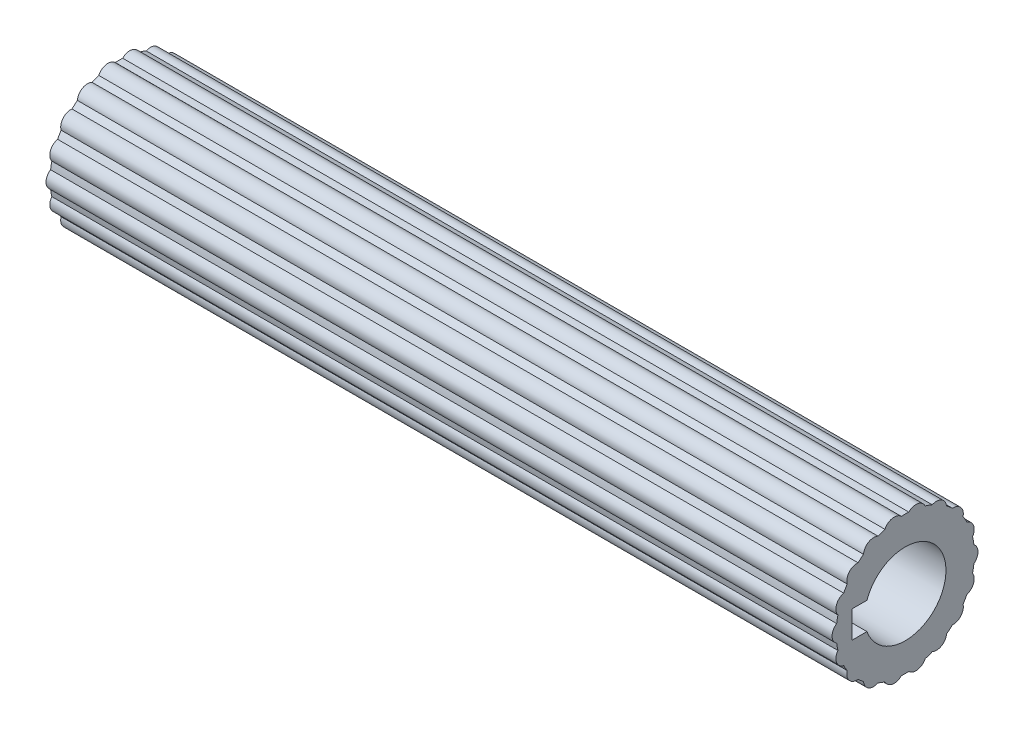
from build123d import *

# Parameters (mm, degrees)
SKETCH1_W               = 30
SKETCH1_H               = 5.1
CIRPATTERN1_COUNT       = 18
CUT_EXTRUDE2_DEPTH      = 1
CUT_EXTRUDE2_DEPTH_BACK = 1
SKETCH13_R              = 5.864313224
CUT_EXTRUDE3_DEPTH      = 1
CUT_EXTRUDE3_DEPTH_BACK = 1
SKETCH14_R              = 6.155891313
CUT_EXTRUDE4_DEPTH      = 59.492599661


with BuildPart() as part:
    # Sketch1 → Revolve1 (revolve)
    with BuildSketch(Plane(origin=(0, 0, 0), x_dir=(-1, 0, 0), z_dir=(0, 1, 0))):
        with Locations((-15, 2.55)):
            Rectangle(SKETCH1_W, SKETCH1_H)
    revolve1 = revolve(axis=Axis((0, 0, 0), (1, 0, 0)))

    # Sweep3: sweep along a path in Sketch2
    with BuildLine(Plane(origin=(0, 0, 0), x_dir=(-1, 0, 0), z_dir=(0, 1, 0))) as sweep3_path:
        Line((-30, 5.1), (0, 5.1))
    # Sketch3 → Sweep3 (sweep)
    with BuildSketch(Plane(origin=(0, 0, 0), x_dir=(0, -1, 0), z_dir=(-1, 0, 0))):
        with BuildLine():
            Line((0.75, 4.65), (0.75, 2.55))
            ThreePointArc((0.75, 2.55), (0, 1.8), (-0.75, 2.55))
            Line((-0.75, 2.55), (-0.75, 4.65))
            ThreePointArc((-0.75, 4.65), (0, 5.4), (0.75, 4.65))
        make_face()
    sweep3 = sweep(path=sweep3_path.line)

    # CirPattern1: Sweep3 ×18 about axis
    cirpattern1_axis = Axis((0, 0, 0.01696711), (1, 0, 0))
    for i in range(1, CIRPATTERN1_COUNT):
        add(sweep3.rotate(cirpattern1_axis, i * 360 / CIRPATTERN1_COUNT))

    # Mirror1: Revolve1, Sweep3 across plane
    add(revolve1.mirror(Plane(origin=(0, 0, 0), x_dir=(0, 0, 1), z_dir=(1, 0, 0))))
    add(sweep3.mirror(Plane(origin=(0, 0, 0), x_dir=(0, 0, 1), z_dir=(1, 0, 0))))

    # Mirror1 copy 1: sweep along a path in Mirror1 copy 1 path
    with BuildLine(Plane(origin=(0, 0.005803093, 0.001023242), x_dir=(1, 0, 0), z_dir=(0, 0.9396926207859084, 0.3420201433256687))) as mirror1_copy_1_path:
        Line((-30, -5.1), (0, -5.1))
    # Mirror1 copy 1 sketch → Mirror1 copy 1 (sweep)
    with BuildSketch(Plane(origin=(0, 0.005803093, 0.001023242), x_dir=(0, -0.9396926207859084, -0.3420201433256687), z_dir=(1, 0, 0))):
        with BuildLine():
            Line((0.75, -4.65), (0.75, -2.55))
            ThreePointArc((0.75, -2.55), (0, -1.8), (-0.75, -2.55))
            Line((-0.75, -2.55), (-0.75, -4.65))
            ThreePointArc((-0.75, -4.65), (0, -5.4), (0.75, -4.65))
        make_face()
    sweep(path=mirror1_copy_1_path.line)

    # Mirror1 copy 2: sweep along a path in Mirror1 copy 2 path
    with BuildLine(Plane(origin=(0, 0.010906248, 0.00396955), x_dir=(1, 0, 0), z_dir=(0, 0.766044443118978, 0.6427876096865393))) as mirror1_copy_2_path:
        Line((-30, -5.1), (0, -5.1))
    # Mirror1 copy 2 sketch → Mirror1 copy 2 (sweep)
    with BuildSketch(Plane(origin=(0, 0.010906248, 0.00396955), x_dir=(0, -0.766044443118978, -0.6427876096865393), z_dir=(1, 0, 0))):
        with BuildLine():
            Line((0.75, -4.65), (0.75, -2.55))
            ThreePointArc((0.75, -2.55), (0, -1.8), (-0.75, -2.55))
            Line((-0.75, -2.55), (-0.75, -4.65))
            ThreePointArc((-0.75, -4.65), (0, -5.4), (0.75, -4.65))
        make_face()
    sweep(path=mirror1_copy_2_path.line)

    # Mirror1 copy 3: sweep along a path in Mirror1 copy 3 path
    with BuildLine(Plane(origin=(0, 0.014693948, 0.008483555), x_dir=(1, 0, 0), z_dir=(0, 0.5000000000000001, 0.8660254037844386))) as mirror1_copy_3_path:
        Line((-30, -5.1), (0, -5.1))
    # Mirror1 copy 3 sketch → Mirror1 copy 3 (sweep)
    with BuildSketch(Plane(origin=(0, 0.014693948, 0.008483555), x_dir=(0, -0.5000000000000001, -0.8660254037844386), z_dir=(1, 0, 0))):
        with BuildLine():
            Line((0.75, -4.65), (0.75, -2.55))
            ThreePointArc((0.75, -2.55), (0, -1.8), (-0.75, -2.55))
            Line((-0.75, -2.55), (-0.75, -4.65))
            ThreePointArc((-0.75, -4.65), (0, -5.4), (0.75, -4.65))
        make_face()
    sweep(path=mirror1_copy_3_path.line)

    # Mirror1 copy 4: sweep along a path in Mirror1 copy 4 path
    with BuildLine(Plane(origin=(0, 0.016709341, 0.014020802), x_dir=(1, 0, 0), z_dir=(0, 0.17364817766693041, 0.984807753012208))) as mirror1_copy_4_path:
        Line((-30, -5.1), (0, -5.1))
    # Mirror1 copy 4 sketch → Mirror1 copy 4 (sweep)
    with BuildSketch(Plane(origin=(0, 0.016709341, 0.014020802), x_dir=(0, -0.17364817766693041, -0.984807753012208), z_dir=(1, 0, 0))):
        with BuildLine():
            Line((0.75, -4.65), (0.75, -2.55))
            ThreePointArc((0.75, -2.55), (0, -1.8), (-0.75, -2.55))
            Line((-0.75, -2.55), (-0.75, -4.65))
            ThreePointArc((-0.75, -4.65), (0, -5.4), (0.75, -4.65))
        make_face()
    sweep(path=mirror1_copy_4_path.line)

    # Mirror1 copy 5: sweep along a path in Mirror1 copy 5 path
    with BuildLine(Plane(origin=(0, 0.016709341, 0.019913417), x_dir=(1, 0, 0), z_dir=(0, -0.1736481776669303, 0.984807753012208))) as mirror1_copy_5_path:
        Line((-30, -5.1), (0, -5.1))
    # Mirror1 copy 5 sketch → Mirror1 copy 5 (sweep)
    with BuildSketch(Plane(origin=(0, 0.016709341, 0.019913417), x_dir=(0, 0.1736481776669303, -0.984807753012208), z_dir=(1, 0, 0))):
        with BuildLine():
            Line((0.75, -4.65), (0.75, -2.55))
            ThreePointArc((0.75, -2.55), (0, -1.8), (-0.75, -2.55))
            Line((-0.75, -2.55), (-0.75, -4.65))
            ThreePointArc((-0.75, -4.65), (0, -5.4), (0.75, -4.65))
        make_face()
    sweep(path=mirror1_copy_5_path.line)

    # Mirror1 copy 6: sweep along a path in Mirror1 copy 6 path
    with BuildLine(Plane(origin=(0, 0.014693948, 0.025450665), x_dir=(1, 0, 0), z_dir=(0, -0.4999999999999998, 0.8660254037844387))) as mirror1_copy_6_path:
        Line((-30, -5.1), (0, -5.1))
    # Mirror1 copy 6 sketch → Mirror1 copy 6 (sweep)
    with BuildSketch(Plane(origin=(0, 0.014693948, 0.025450665), x_dir=(0, 0.4999999999999998, -0.8660254037844387), z_dir=(1, 0, 0))):
        with BuildLine():
            Line((0.75, -4.65), (0.75, -2.55))
            ThreePointArc((0.75, -2.55), (0, -1.8), (-0.75, -2.55))
            Line((-0.75, -2.55), (-0.75, -4.65))
            ThreePointArc((-0.75, -4.65), (0, -5.4), (0.75, -4.65))
        make_face()
    sweep(path=mirror1_copy_6_path.line)

    # Mirror1 copy 7: sweep along a path in Mirror1 copy 7 path
    with BuildLine(Plane(origin=(0, 0.010906248, 0.02996467), x_dir=(1, 0, 0), z_dir=(0, -0.7660444431189779, 0.6427876096865395))) as mirror1_copy_7_path:
        Line((-30, -5.1), (0, -5.1))
    # Mirror1 copy 7 sketch → Mirror1 copy 7 (sweep)
    with BuildSketch(Plane(origin=(0, 0.010906248, 0.02996467), x_dir=(0, 0.7660444431189779, -0.6427876096865395), z_dir=(1, 0, 0))):
        with BuildLine():
            Line((0.75, -4.65), (0.75, -2.55))
            ThreePointArc((0.75, -2.55), (0, -1.8), (-0.75, -2.55))
            Line((-0.75, -2.55), (-0.75, -4.65))
            ThreePointArc((-0.75, -4.65), (0, -5.4), (0.75, -4.65))
        make_face()
    sweep(path=mirror1_copy_7_path.line)

    # Mirror1 copy 8: sweep along a path in Mirror1 copy 8 path
    with BuildLine(Plane(origin=(0, 0.005803093, 0.032910978), x_dir=(1, 0, 0), z_dir=(0, -0.9396926207859083, 0.3420201433256689))) as mirror1_copy_8_path:
        Line((-30, -5.1), (0, -5.1))
    # Mirror1 copy 8 sketch → Mirror1 copy 8 (sweep)
    with BuildSketch(Plane(origin=(0, 0.005803093, 0.032910978), x_dir=(0, 0.9396926207859083, -0.3420201433256689), z_dir=(1, 0, 0))):
        with BuildLine():
            Line((0.75, -4.65), (0.75, -2.55))
            ThreePointArc((0.75, -2.55), (0, -1.8), (-0.75, -2.55))
            Line((-0.75, -2.55), (-0.75, -4.65))
            ThreePointArc((-0.75, -4.65), (0, -5.4), (0.75, -4.65))
        make_face()
    sweep(path=mirror1_copy_8_path.line)

    # Mirror1 copy 9: sweep along a path in Mirror1 copy 9 path
    with BuildLine(Plane(origin=(0, 0, 0.03393422), x_dir=(1, 0, 0), z_dir=(0, -1, 0))) as mirror1_copy_9_path:
        Line((-30, -5.1), (0, -5.1))
    # Mirror1 copy 9 sketch → Mirror1 copy 9 (sweep)
    with BuildSketch(Plane(origin=(0, 0, 0.03393422), x_dir=(0, 1, 0), z_dir=(1, 0, 0))):
        with BuildLine():
            Line((0.75, -4.65), (0.75, -2.55))
            ThreePointArc((0.75, -2.55), (0, -1.8), (-0.75, -2.55))
            Line((-0.75, -2.55), (-0.75, -4.65))
            ThreePointArc((-0.75, -4.65), (0, -5.4), (0.75, -4.65))
        make_face()
    sweep(path=mirror1_copy_9_path.line)

    # Mirror1 copy 10: sweep along a path in Mirror1 copy 10 path
    with BuildLine(Plane(origin=(0, -0.005803093, 0.032910978), x_dir=(1, 0, 0), z_dir=(0, -0.9396926207859084, -0.34202014332566866))) as mirror1_copy_10_path:
        Line((-30, -5.1), (0, -5.1))
    # Mirror1 copy 10 sketch → Mirror1 copy 10 (sweep)
    with BuildSketch(Plane(origin=(0, -0.005803093, 0.032910978), x_dir=(0, 0.9396926207859084, 0.34202014332566866), z_dir=(1, 0, 0))):
        with BuildLine():
            Line((0.75, -4.65), (0.75, -2.55))
            ThreePointArc((0.75, -2.55), (0, -1.8), (-0.75, -2.55))
            Line((-0.75, -2.55), (-0.75, -4.65))
            ThreePointArc((-0.75, -4.65), (0, -5.4), (0.75, -4.65))
        make_face()
    sweep(path=mirror1_copy_10_path.line)

    # Mirror1 copy 11: sweep along a path in Mirror1 copy 11 path
    with BuildLine(Plane(origin=(0, -0.010906248, 0.02996467), x_dir=(1, 0, 0), z_dir=(0, -0.766044443118978, -0.6427876096865393))) as mirror1_copy_11_path:
        Line((-30, -5.1), (0, -5.1))
    # Mirror1 copy 11 sketch → Mirror1 copy 11 (sweep)
    with BuildSketch(Plane(origin=(0, -0.010906248, 0.02996467), x_dir=(0, 0.766044443118978, 0.6427876096865393), z_dir=(1, 0, 0))):
        with BuildLine():
            Line((0.75, -4.65), (0.75, -2.55))
            ThreePointArc((0.75, -2.55), (0, -1.8), (-0.75, -2.55))
            Line((-0.75, -2.55), (-0.75, -4.65))
            ThreePointArc((-0.75, -4.65), (0, -5.4), (0.75, -4.65))
        make_face()
    sweep(path=mirror1_copy_11_path.line)

    # Mirror1 copy 12: sweep along a path in Mirror1 copy 12 path
    with BuildLine(Plane(origin=(0, -0.014693948, 0.025450665), x_dir=(1, 0, 0), z_dir=(0, -0.5000000000000004, -0.8660254037844384))) as mirror1_copy_12_path:
        Line((-30, -5.1), (0, -5.1))
    # Mirror1 copy 12 sketch → Mirror1 copy 12 (sweep)
    with BuildSketch(Plane(origin=(0, -0.014693948, 0.025450665), x_dir=(0, 0.5000000000000004, 0.8660254037844384), z_dir=(1, 0, 0))):
        with BuildLine():
            Line((0.75, -4.65), (0.75, -2.55))
            ThreePointArc((0.75, -2.55), (0, -1.8), (-0.75, -2.55))
            Line((-0.75, -2.55), (-0.75, -4.65))
            ThreePointArc((-0.75, -4.65), (0, -5.4), (0.75, -4.65))
        make_face()
    sweep(path=mirror1_copy_12_path.line)

    # Mirror1 copy 13: sweep along a path in Mirror1 copy 13 path
    with BuildLine(Plane(origin=(0, -0.016709341, 0.019913417), x_dir=(1, 0, 0), z_dir=(0, -0.17364817766693033, -0.984807753012208))) as mirror1_copy_13_path:
        Line((-30, -5.1), (0, -5.1))
    # Mirror1 copy 13 sketch → Mirror1 copy 13 (sweep)
    with BuildSketch(Plane(origin=(0, -0.016709341, 0.019913417), x_dir=(0, 0.17364817766693033, 0.984807753012208), z_dir=(1, 0, 0))):
        with BuildLine():
            Line((0.75, -4.65), (0.75, -2.55))
            ThreePointArc((0.75, -2.55), (0, -1.8), (-0.75, -2.55))
            Line((-0.75, -2.55), (-0.75, -4.65))
            ThreePointArc((-0.75, -4.65), (0, -5.4), (0.75, -4.65))
        make_face()
    sweep(path=mirror1_copy_13_path.line)

    # Mirror1 copy 14: sweep along a path in Mirror1 copy 14 path
    with BuildLine(Plane(origin=(0, -0.016709341, 0.014020802), x_dir=(1, 0, 0), z_dir=(0, 0.17364817766692997, -0.9848077530122081))) as mirror1_copy_14_path:
        Line((-30, -5.1), (0, -5.1))
    # Mirror1 copy 14 sketch → Mirror1 copy 14 (sweep)
    with BuildSketch(Plane(origin=(0, -0.016709341, 0.014020802), x_dir=(0, -0.17364817766692997, 0.9848077530122081), z_dir=(1, 0, 0))):
        with BuildLine():
            Line((0.75, -4.65), (0.75, -2.55))
            ThreePointArc((0.75, -2.55), (0, -1.8), (-0.75, -2.55))
            Line((-0.75, -2.55), (-0.75, -4.65))
            ThreePointArc((-0.75, -4.65), (0, -5.4), (0.75, -4.65))
        make_face()
    sweep(path=mirror1_copy_14_path.line)

    # Mirror1 copy 15: sweep along a path in Mirror1 copy 15 path
    with BuildLine(Plane(origin=(0, -0.014693948, 0.008483555), x_dir=(1, 0, 0), z_dir=(0, 0.5000000000000001, -0.8660254037844386))) as mirror1_copy_15_path:
        Line((-30, -5.1), (0, -5.1))
    # Mirror1 copy 15 sketch → Mirror1 copy 15 (sweep)
    with BuildSketch(Plane(origin=(0, -0.014693948, 0.008483555), x_dir=(0, -0.5000000000000001, 0.8660254037844386), z_dir=(1, 0, 0))):
        with BuildLine():
            Line((0.75, -4.65), (0.75, -2.55))
            ThreePointArc((0.75, -2.55), (0, -1.8), (-0.75, -2.55))
            Line((-0.75, -2.55), (-0.75, -4.65))
            ThreePointArc((-0.75, -4.65), (0, -5.4), (0.75, -4.65))
        make_face()
    sweep(path=mirror1_copy_15_path.line)

    # Mirror1 copy 16: sweep along a path in Mirror1 copy 16 path
    with BuildLine(Plane(origin=(0, -0.010906248, 0.00396955), x_dir=(1, 0, 0), z_dir=(0, 0.7660444431189778, -0.6427876096865396))) as mirror1_copy_16_path:
        Line((-30, -5.1), (0, -5.1))
    # Mirror1 copy 16 sketch → Mirror1 copy 16 (sweep)
    with BuildSketch(Plane(origin=(0, -0.010906248, 0.00396955), x_dir=(0, -0.7660444431189778, 0.6427876096865396), z_dir=(1, 0, 0))):
        with BuildLine():
            Line((0.75, -4.65), (0.75, -2.55))
            ThreePointArc((0.75, -2.55), (0, -1.8), (-0.75, -2.55))
            Line((-0.75, -2.55), (-0.75, -4.65))
            ThreePointArc((-0.75, -4.65), (0, -5.4), (0.75, -4.65))
        make_face()
    sweep(path=mirror1_copy_16_path.line)

    # Mirror1 copy 17: sweep along a path in Mirror1 copy 17 path
    with BuildLine(Plane(origin=(0, -0.005803093, 0.001023242), x_dir=(1, 0, 0), z_dir=(0, 0.9396926207859084, -0.3420201433256686))) as mirror1_copy_17_path:
        Line((-30, -5.1), (0, -5.1))
    # Mirror1 copy 17 sketch → Mirror1 copy 17 (sweep)
    with BuildSketch(Plane(origin=(0, -0.005803093, 0.001023242), x_dir=(0, -0.9396926207859084, 0.3420201433256686), z_dir=(1, 0, 0))):
        with BuildLine():
            Line((0.75, -4.65), (0.75, -2.55))
            ThreePointArc((0.75, -2.55), (0, -1.8), (-0.75, -2.55))
            Line((-0.75, -2.55), (-0.75, -4.65))
            ThreePointArc((-0.75, -4.65), (0, -5.4), (0.75, -4.65))
        make_face()
    sweep(path=mirror1_copy_17_path.line)

    # Sketch13 → Cut-Extrude2 (cut, two sides: drawn at the far end of the back side and taken through both)
    with BuildSketch(Plane(origin=(-30, 0, 0), x_dir=(0, -1, 0), z_dir=(-1, 0, 0)).offset(-CUT_EXTRUDE2_DEPTH_BACK)):
        Circle(SKETCH13_R)
    extrude(amount=CUT_EXTRUDE2_DEPTH + CUT_EXTRUDE2_DEPTH_BACK, mode=Mode.SUBTRACT)

    # Sketch14 → Cut-Extrude3 (cut, two sides: drawn at the far end of the back side and taken through both)
    with BuildSketch(Plane.YZ.offset(30).offset(-CUT_EXTRUDE3_DEPTH_BACK)):
        Circle(SKETCH14_R)
    extrude(amount=CUT_EXTRUDE3_DEPTH + CUT_EXTRUDE3_DEPTH_BACK, mode=Mode.SUBTRACT)

    # Sketch15 → Cut-Extrude4 (cut, through all)
    with BuildSketch(Plane(origin=(-29, 0, 0), x_dir=(0, -1, 0), z_dir=(-1, 0, 0))):
        with BuildLine():
            Line((-1, 3.928427125), (1, 3.928427125))
            Line((1, 3.928427125), (1, 2.828427125))
            ThreePointArc((1, 2.828427125), (0, -3), (-1, 2.828427125))
            Line((-1, 2.828427125), (-1, 3.928427125))
        make_face()
    extrude(amount=-CUT_EXTRUDE4_DEPTH, mode=Mode.SUBTRACT)


solid = part.part
